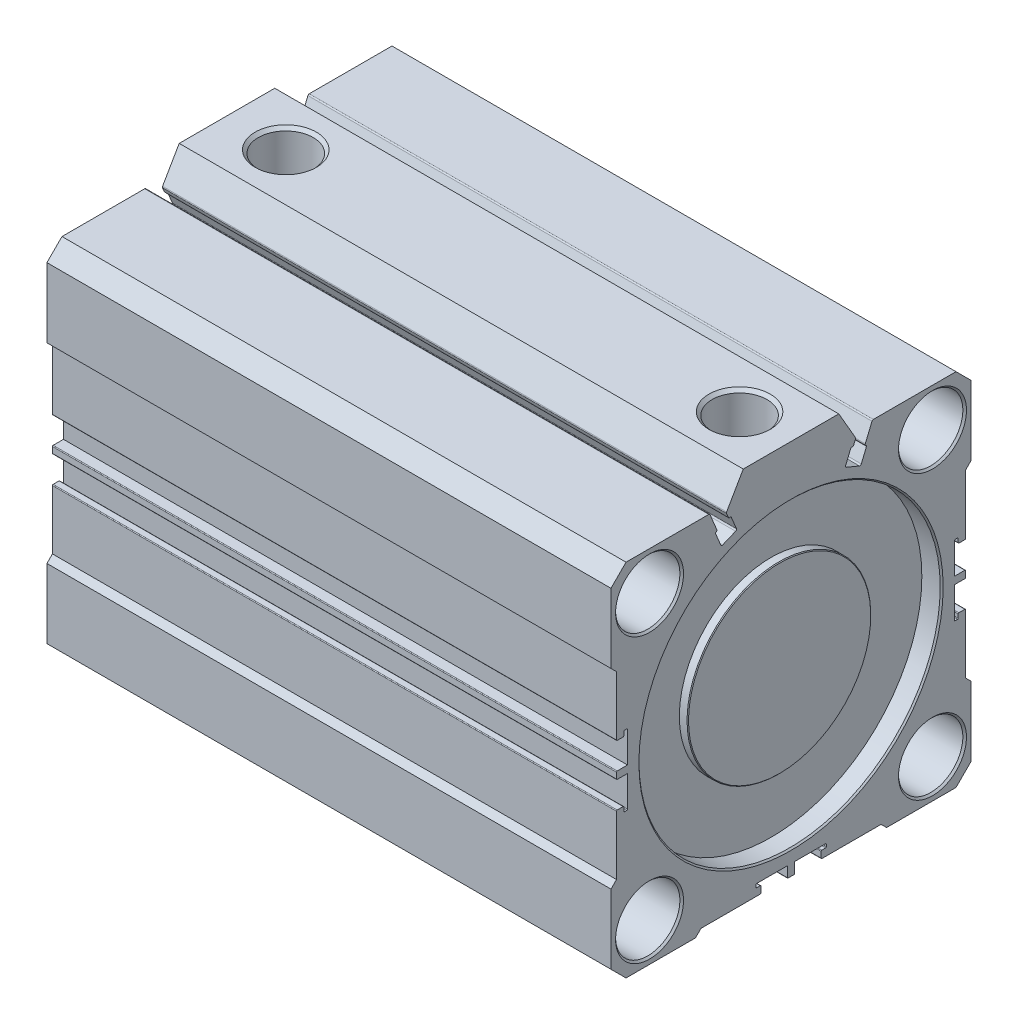
from build123d import *

# Parameters (mm, degrees)
EXTRUDE_1_DEPTH             = 153.5
PATTERN_LINEAR_1_COUNT      = 2
PATTERN_LINEAR_1_PITCH      = 77
PATTERN_LINEAR_1_COUNT_DIR2 = 2
PATTERN_LINEAR_1_PITCH_DIR2 = 77
PATTERN_LINEAR_2_COUNT      = 2
PATTERN_LINEAR_2_PITCH      = 77
PATTERN_LINEAR_2_COUNT_DIR2 = 2
PATTERN_LINEAR_2_PITCH_DIR2 = 77
HOLE_WIZARD_1_D             = 14.95
HOLE_WIZARD_1_DEPTH         = 12
HOLE_WIZARD_1_CSINK_D       = 16.662
HOLE_WIZARD_1_CSINK_ANGLE   = 90
HOLE_WIZARD_2_D             = 14.95
HOLE_WIZARD_2_DEPTH         = 12
HOLE_WIZARD_2_CSINK_D       = 16.662
HOLE_WIZARD_2_CSINK_ANGLE   = 90


with BuildPart() as part:
    # 草图1 → 凸台-拉伸1 (new body)
    with BuildSketch(Plane(origin=(0, 0, 0), x_dir=(0, 0, -1), z_dir=(1, 0, 0))):
        with BuildLine():
            Line((-49, -44.9), (-44.9, -49))
            Line((-44.9, -49), (-26, -49))
            Line((-26, -49), (-24.5, -47.5))
            Line((-24.5, -47.5), (-8.4, -47.5))
            ThreePointArc((-8.4, -47.5), (-8.258578644, -47.441421356), (-8.2, -47.3))
            Line((-8.2, -47.3), (-8.2, -45.7))
            ThreePointArc((-8.2, -45.7), (-8.258578644, -45.558578644), (-8.4, -45.5))
            Line((-8.4, -45.5), (-9.4, -45.5))
            ThreePointArc((-9.4, -45.5), (-9.541421356, -45.441421356), (-9.6, -45.3))
            Line((-9.6, -45.3), (-9.6, -44.7))
            ThreePointArc((-9.6, -44.7), (-9.541421356, -44.558578644), (-9.4, -44.5))
            Line((-9.4, -44.5), (-1, -44.5))
            Line((-1, -44.5), (-1, -47.3))
            ThreePointArc((-1, -47.3), (-0.941421356, -47.441421356), (-0.8, -47.5))
            Line((-0.8, -47.5), (0.8, -47.5))
            ThreePointArc((0.8, -47.5), (0.941421356, -47.441421356), (1, -47.3))
            Line((1, -47.3), (1, -44.5))
            Line((1, -44.5), (9.4, -44.5))
            ThreePointArc((9.4, -44.5), (9.541421356, -44.558578644), (9.6, -44.7))
            Line((9.6, -44.7), (9.6, -45.3))
            ThreePointArc((9.6, -45.3), (9.541421356, -45.441421356), (9.4, -45.5))
            Line((9.4, -45.5), (8.4, -45.5))
            ThreePointArc((8.4, -45.5), (8.258578644, -45.558578644), (8.2, -45.7))
            Line((8.2, -45.7), (8.2, -47.3))
            ThreePointArc((8.2, -47.3), (8.258578644, -47.441421356), (8.4, -47.5))
            Line((8.4, -47.5), (24.5, -47.5))
            Line((24.5, -47.5), (26, -49))
            Line((26, -49), (44.9, -49))
            Line((44.9, -49), (49, -44.9))
            Line((49, -44.9), (49, -26))
            Line((49, -26), (47.5, -24.5))
            Line((47.5, -24.5), (47.5, -8.4))
            ThreePointArc((47.5, -8.4), (47.441421356, -8.258578644), (47.3, -8.2))
            Line((47.3, -8.2), (45.7, -8.2))
            ThreePointArc((45.7, -8.2), (45.558578644, -8.258578644), (45.5, -8.4))
            Line((45.5, -8.4), (45.5, -9.4))
            ThreePointArc((45.5, -9.4), (45.441421356, -9.541421356), (45.3, -9.6))
            Line((45.3, -9.6), (44.7, -9.6))
            ThreePointArc((44.7, -9.6), (44.558578644, -9.541421356), (44.5, -9.4))
            Line((44.5, -9.4), (44.5, -1))
            Line((44.5, -1), (47.3, -1))
            ThreePointArc((47.3, -1), (47.441421356, -0.941421356), (47.5, -0.8))
            Line((47.5, -0.8), (47.5, 0.8))
            ThreePointArc((47.5, 0.8), (47.441421356, 0.941421356), (47.3, 1))
            Line((47.3, 1), (44.5, 1))
            Line((44.5, 1), (44.5, 9.4))
            ThreePointArc((44.5, 9.4), (44.558578644, 9.541421356), (44.7, 9.6))
            Line((44.7, 9.6), (45.3, 9.6))
            ThreePointArc((45.3, 9.6), (45.441421356, 9.541421356), (45.5, 9.4))
            Line((45.5, 9.4), (45.5, 8.4))
            ThreePointArc((45.5, 8.4), (45.558578644, 8.258578644), (45.7, 8.2))
            Line((45.7, 8.2), (47.3, 8.2))
            ThreePointArc((47.3, 8.2), (47.441421356, 8.258578644), (47.5, 8.4))
            Line((47.5, 8.4), (47.5, 24.5))
            Line((47.5, 24.5), (49, 26))
            Line((49, 26), (49, 44.9))
            Line((49, 44.9), (44.9, 49))
            Line((44.9, 49), (22.403802752, 49))
            ThreePointArc((22.403802752, 49), (22.181574659, 48.932587845), (22.034250939, 48.753073373))
            Line((22.034250939, 48.753073373), (20.207278361, 44.342371398))
            ThreePointArc((20.207278361, 44.342371398), (20.207278361, 44.036224652), (20.423756802, 43.819746212))
            ThreePointArc((20.423756802, 43.819746212), (20.531996022, 43.711506992), (20.531996022, 43.558433619))
            Line((20.531996022, 43.558433619), (19.116067322, 40.140079349))
            ThreePointArc((19.116067322, 40.140079349), (18.899588882, 39.923600909), (18.593442136, 39.923600909))
            Line((18.593442136, 39.923600909), (15.082699912, 41.377797952))
            ThreePointArc((15.082699912, 41.377797952), (14.866221472, 41.594276392), (14.866221472, 41.900423138))
            Line((14.866221472, 41.900423138), (16.282150172, 45.318777408))
            ThreePointArc((16.282150172, 45.318777408), (16.390389392, 45.427016628), (16.543462765, 45.427016628))
            ThreePointArc((16.543462765, 45.427016628), (16.849609511, 45.427016628), (17.066087951, 45.643495068))
            Line((17.066087951, 45.643495068), (17.548653214, 46.808510671))
            ThreePointArc((17.548653214, 46.808510671), (17.57824497, 46.987745295), (17.525511562, 47.161584044))
            Line((17.525511562, 47.161584044), (13, 55))
            Line((13, 55), (-13, 55))
            Line((-13, 55), (-17.525511562, 47.161584044))
            ThreePointArc((-17.525511562, 47.161584044), (-17.57824497, 46.987745295), (-17.548653214, 46.808510671))
            Line((-17.548653214, 46.808510671), (-17.066087951, 45.643495068))
            ThreePointArc((-17.066087951, 45.643495068), (-16.849609511, 45.427016628), (-16.543462765, 45.427016628))
            ThreePointArc((-16.543462765, 45.427016628), (-16.390389392, 45.427016628), (-16.282150172, 45.318777408))
            Line((-16.282150172, 45.318777408), (-14.866221472, 41.900423138))
            ThreePointArc((-14.866221472, 41.900423138), (-14.866221472, 41.594276392), (-15.082699912, 41.377797952))
            Line((-15.082699912, 41.377797952), (-18.593442136, 39.923600909))
            ThreePointArc((-18.593442136, 39.923600909), (-18.899588882, 39.923600909), (-19.116067322, 40.140079349))
            Line((-19.116067322, 40.140079349), (-20.531996022, 43.558433619))
            ThreePointArc((-20.531996022, 43.558433619), (-20.531996022, 43.711506992), (-20.423756802, 43.819746212))
            ThreePointArc((-20.423756802, 43.819746212), (-20.207278361, 44.036224652), (-20.207278361, 44.342371398))
            Line((-20.207278361, 44.342371398), (-22.034250939, 48.753073373))
            ThreePointArc((-22.034250939, 48.753073373), (-22.181574659, 48.932587845), (-22.403802752, 49))
            Line((-22.403802752, 49), (-44.9, 49))
            Line((-44.9, 49), (-49, 44.9))
            Line((-49, 44.9), (-49, 26))
            Line((-49, 26), (-47.5, 24.5))
            Line((-47.5, 24.5), (-47.5, 8.4))
            ThreePointArc((-47.5, 8.4), (-47.441421356, 8.258578644), (-47.3, 8.2))
            Line((-47.3, 8.2), (-45.7, 8.2))
            ThreePointArc((-45.7, 8.2), (-45.558578644, 8.258578644), (-45.5, 8.4))
            Line((-45.5, 8.4), (-45.5, 9.4))
            ThreePointArc((-45.5, 9.4), (-45.441421356, 9.541421356), (-45.3, 9.6))
            Line((-45.3, 9.6), (-44.7, 9.6))
            ThreePointArc((-44.7, 9.6), (-44.558578644, 9.541421356), (-44.5, 9.4))
            Line((-44.5, 9.4), (-44.5, 1))
            Line((-44.5, 1), (-47.3, 1))
            ThreePointArc((-47.3, 1), (-47.441421356, 0.941421356), (-47.5, 0.8))
            Line((-47.5, 0.8), (-47.5, -0.8))
            ThreePointArc((-47.5, -0.8), (-47.441421356, -0.941421356), (-47.3, -1))
            Line((-47.3, -1), (-44.5, -1))
            Line((-44.5, -1), (-44.5, -9.4))
            ThreePointArc((-44.5, -9.4), (-44.558578644, -9.541421356), (-44.7, -9.6))
            Line((-44.7, -9.6), (-45.3, -9.6))
            ThreePointArc((-45.3, -9.6), (-45.441421356, -9.541421356), (-45.5, -9.4))
            Line((-45.5, -9.4), (-45.5, -8.4))
            ThreePointArc((-45.5, -8.4), (-45.558578644, -8.258578644), (-45.7, -8.2))
            Line((-45.7, -8.2), (-47.3, -8.2))
            ThreePointArc((-47.3, -8.2), (-47.441421356, -8.258578644), (-47.5, -8.4))
            Line((-47.5, -8.4), (-47.5, -24.5))
            Line((-47.5, -24.5), (-49, -26))
            Line((-49, -26), (-49, -44.9))
        make_face()
    extrude(amount=EXTRUDE_1_DEPTH)

    # 草图2 → 切除-旋转1 (revolve, cut)
    with BuildSketch(Plane.XY.offset(38.5)):
        Polygon((0, -38.5), (0, -29.25), (0.5, -29.75), (13.5, -29.75), (13.5, -32.5), (14.447, -33.447), (76.75, -33.447), (76.75, -38.5), align=None)
    cut_revolve_1 = revolve(axis=Axis((76.75, -38.5, 38.5), (-1, 0, 0)), mode=Mode.SUBTRACT)

    # 阵列(线性)1: Cut-Revolve 1 2 × 2
    with Locations(*[(0, j * PATTERN_LINEAR_1_PITCH_DIR2, -i * PATTERN_LINEAR_1_PITCH) for i in range(PATTERN_LINEAR_1_COUNT) for j in range(PATTERN_LINEAR_1_COUNT_DIR2) if (i, j) != (0, 0)]):
        add(cut_revolve_1, mode=Mode.SUBTRACT)

    # 草图4 → 切除-旋转2 (revolve, cut)
    with BuildSketch(Plane.XY.offset(38.5)):
        Polygon((76.75, -38.5), (76.75, -33.447), (139.053, -33.447), (140, -32.5), (140, -29.75), (153, -29.75), (153.5, -29.25), (153.5, -38.5), align=None)
    cut_revolve_2 = revolve(axis=Axis((153.5, -38.5, 38.5), (-1, 0, 0)), mode=Mode.SUBTRACT)

    # 阵列(线性)2: Cut-Revolve 2 2 × 2
    with Locations(*[(0, j * PATTERN_LINEAR_2_PITCH_DIR2, -i * PATTERN_LINEAR_2_PITCH) for i in range(PATTERN_LINEAR_2_COUNT) for j in range(PATTERN_LINEAR_2_COUNT_DIR2) if (i, j) != (0, 0)]):
        add(cut_revolve_2, mode=Mode.SUBTRACT)

    # 草图6 → 切除-旋转3 (revolve, cut)
    with BuildSketch(Plane.XY):
        Polygon((0, 0), (0, 12.5), (15.4, 12.5), (15.4, 40), (142.5, 40), (142.5, 0), align=None)
    revolve(axis=Axis((142.5, 0, 0), (-1, 0, 0)), mode=Mode.SUBTRACT)

    # 草图7 → 切除-旋转4 (revolve, cut)
    with BuildSketch(Plane.XY):
        Polygon((0, 0), (0, 41.4), (0.4, 41), (5.4, 41), (5.4, 0), align=None)
    revolve(axis=Axis((5.4, 0, 0), (-1, 0, 0)), mode=Mode.SUBTRACT)

    # 孔1
    with Locations(Plane(origin=(0, 55, 0), x_dir=(1, 0, 0), z_dir=(0, 1, 0))):
        with Locations((16, 0)):
            CounterSinkHole(HOLE_WIZARD_1_D / 2, HOLE_WIZARD_1_CSINK_D / 2, depth=HOLE_WIZARD_1_DEPTH, counter_sink_angle=HOLE_WIZARD_1_CSINK_ANGLE)

    # 孔2
    with Locations(Plane(origin=(0, 55, 0), x_dir=(1, 0, 0), z_dir=(0, 1, 0))):
        with Locations((139.5, 0)):
            CounterSinkHole(HOLE_WIZARD_2_D / 2, HOLE_WIZARD_2_CSINK_D / 2, depth=HOLE_WIZARD_2_DEPTH, counter_sink_angle=HOLE_WIZARD_2_CSINK_ANGLE)

    # 草图12 → 旋转1 (revolve)
    with BuildSketch(Plane.XY):
        with BuildLine():
            Line((0.7, 12.5), (5.4, 12.5))
            Line((5.4, 12.5), (5.4, 25))
            Line((5.4, 25), (1.7, 25))
            ThreePointArc((1.7, 25), (0.992893219, 24.707106781), (0.7, 24))
            Line((0.7, 24), (0.7, 12.5))
        make_face()
    revolve(axis=Axis((5.4, 0, 0), (-1, 0, 0)))

    # 草图13 → 孔3 (revolve, cut)
    with BuildSketch(Plane(origin=(153.5, 0, 0), x_dir=(0, 0, -1), z_dir=(0, 1, 0))):
        Polygon((0, 0), (0, 5.4), (41, 5.4), (41, 0.4), (41.4, 0), align=None)
    revolve(axis=Axis((159.945314094, 0, 0), (-1, 0, 0)), mode=Mode.SUBTRACT)

    # 草图15 → 旋转2 (revolve)
    with BuildSketch(Plane.XY):
        Polygon((148.1, 0), (148.1, 25), (150.2, 25), (150.4, 24.8), (150.4, 0), align=None)
    revolve(axis=Axis((150.4, 0, 0), (-1, 0, 0)))


solid = part.part
